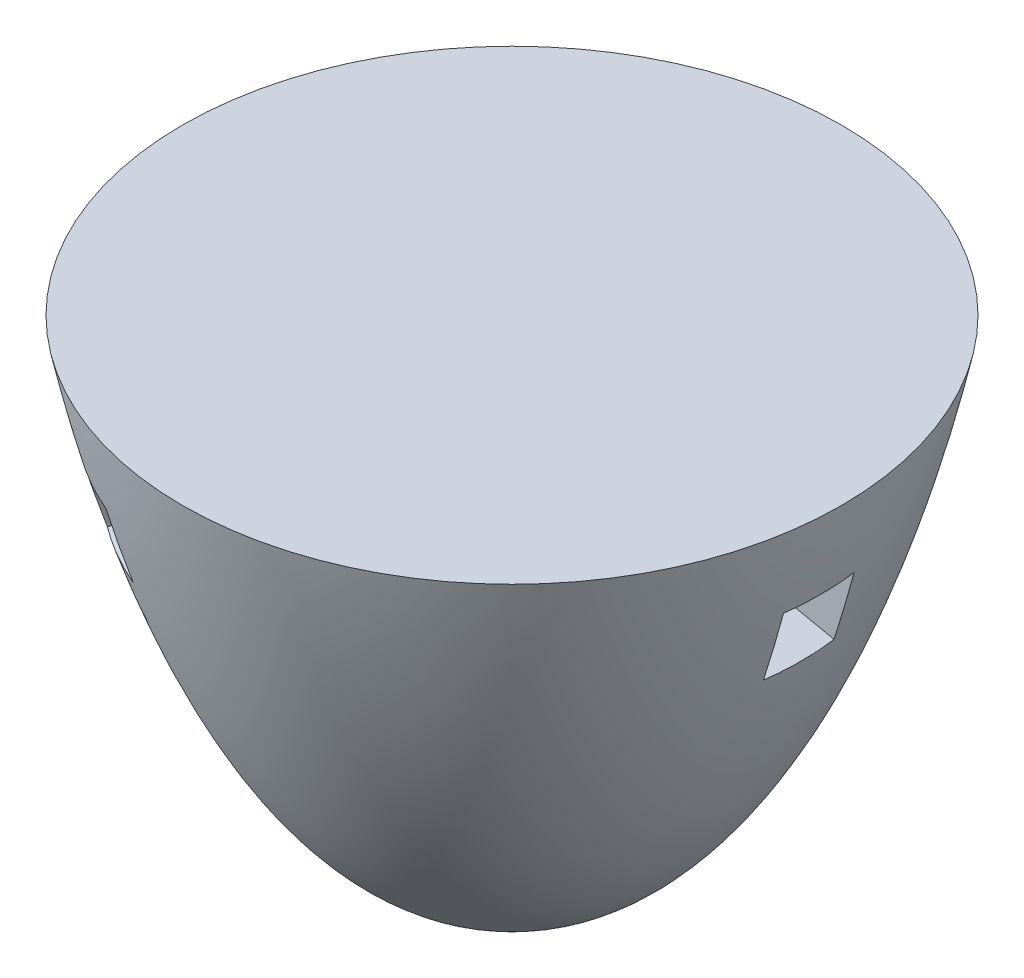
from build123d import *

# Parameters (mm, degrees)
ENL_V_MAT_EXTRU_1_DEPTH      = 1.5
R_P_TITION_CIRCULAIRE1_COUNT = 3


with BuildPart() as part:
    # Esquisse1 → Révolution1 (revolve)
    with BuildSketch(Plane.XY):
        with BuildLine():
            Line((-14, 4.86253393), (0, 4.86253393))
            Line((0, 4.86253393), (0, -16))
            add(Edge.make_bspline(
                [(-14, 4.86253393), (-12.085828485, -4.33132409), (-7.615170337, -16.338293634), (0, -16)],
                knots=[0, 0, 0, 0, 1, 1, 1, 1], degree=3))
        make_face()
    revolve(axis=Axis((0, 4.86253393, 0), (0, -1, 0)))

    # Esquisse2 → Enlèv. mat.-Extru.1 (cut, symmetric)
    with BuildSketch(Plane.XY):
        Polygon((13.219949482, 1.127759621), (8.325564148, 2.150008223), (7.712214987, -0.786622978), (12.60660032, -1.80887158), align=None)
    enl_v_mat_extru_1 = extrude(amount=ENL_V_MAT_EXTRU_1_DEPTH, both=True, mode=Mode.SUBTRACT)

    # Répétition circulaire1: Enlèv. mat.-Extru.1 ×3 about axis
    r_p_tition_circulaire1_axis = Axis((0, 4.86253393, 0), (0, 1, 0))
    for i in range(1, R_P_TITION_CIRCULAIRE1_COUNT):
        add(enl_v_mat_extru_1.rotate(r_p_tition_circulaire1_axis, i * 360 / R_P_TITION_CIRCULAIRE1_COUNT), mode=Mode.SUBTRACT)


solid = part.part
